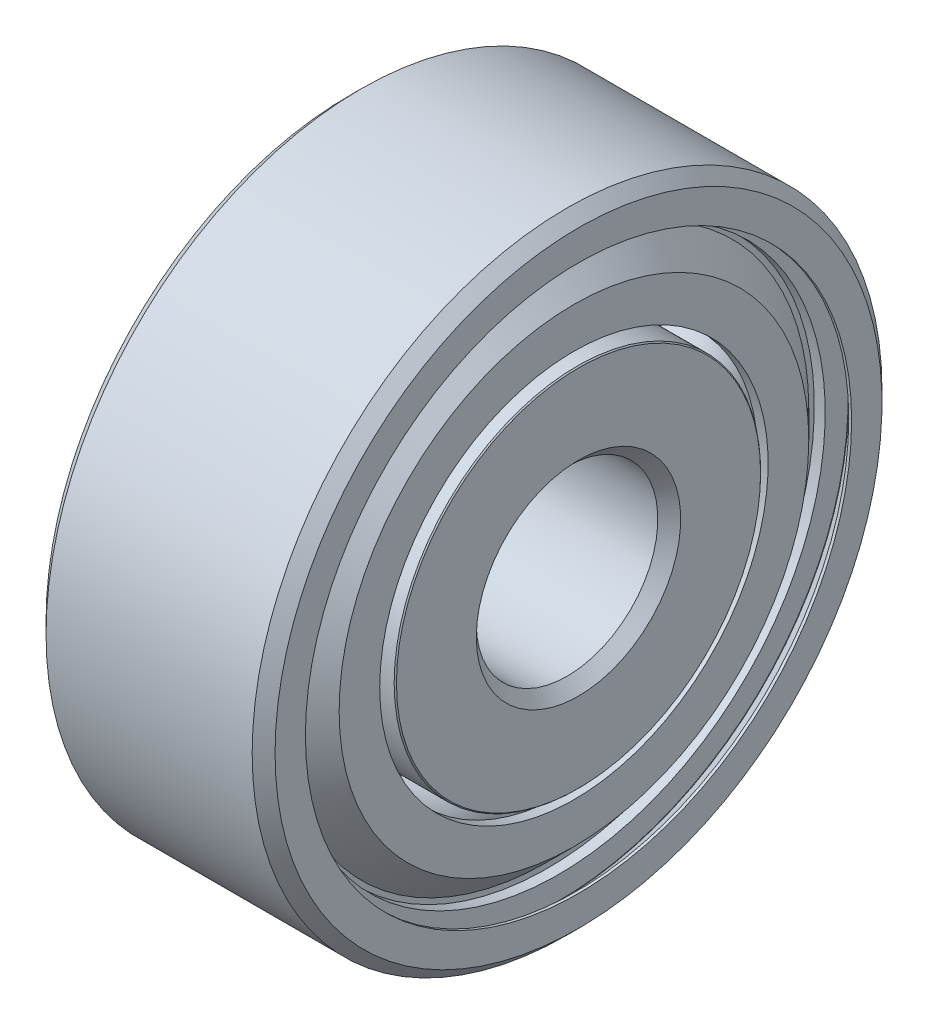
from build123d import *
from build123d.topology import SkipClean

# Parameters (mm, degrees)
SKETCH1_4_W       = 0.19
SKETCH1_4_H       = 0.4
CIRPATTERN2_COUNT = 8


with BuildPart() as part:
    # Sketch1 → Revolve1 (revolve)
    with BuildSketch(Plane.XY, mode=Mode.PRIVATE) as revolve1_sk:
        with BuildLine():
            ThreePointArc((1.00871205, 4.5), (0, 5.05), (-1.00871205, 4.5))
            Line((-1.00871205, 4.5), (-1.25, 4.5))
            Line((-1.25, 4.5), (-1.25, 4.77))
            Line((-1.25, 4.77), (-1.45, 4.77))
            Line((-1.45, 4.77), (-1.45, 5.07))
            Line((-1.45, 5.07), (-1.65, 5.07))
            Line((-1.65, 5.07), (-1.95, 4.77))
            Line((-1.95, 4.77), (-2, 4.77))
            Line((-2, 4.77), (-2, 5.3))
            Line((-2, 5.3), (-1.8, 5.5))
            Line((-1.8, 5.5), (1.8, 5.5))
            Line((1.8, 5.5), (2, 5.3))
            Line((2, 5.3), (2, 4.77))
            Line((2, 4.77), (1.95, 4.77))
            Line((1.95, 4.77), (1.65, 5.07))
            Line((1.65, 5.07), (1.45, 5.07))
            Line((1.45, 5.07), (1.45, 4.77))
            Line((1.45, 4.77), (1.25, 4.77))
            Line((1.25, 4.77), (1.25, 4.5))
            Line((1.25, 4.5), (1.00871205, 4.5))
        make_face()
        with BuildLine():
            ThreePointArc((-1.00871205, 3.2), (0, 2.65), (1.00871205, 3.2))
            Line((1.00871205, 3.2), (1.98, 3.2))
            Line((1.98, 3.2), (2, 3.18))
            Line((2, 3.18), (2, 1.785))
            Line((2, 1.785), (1.8, 1.585))
            Line((1.8, 1.585), (-1.8, 1.585))
            Line((-1.8, 1.585), (-2, 1.785))
            Line((-2, 1.785), (-2, 3.18))
            Line((-2, 3.18), (-1.98, 3.2))
            Line((-1.98, 3.2), (-1.00871205, 3.2))
        make_face()
    revolve(revolve1_sk.sketch.rotate(Axis((0, 0, 0), (1, 0, 0)), 90), axis=Axis((0, 0, 0), (1, 0, 0)))


with BuildPart() as body_2:
    # Sketch1<3> → Revolve2 (revolve)
    with BuildSketch(Plane.XY, mode=Mode.PRIVATE) as revolve2_sk:
        Polygon((1.92036514, 4.101237783), (1.92036514, 3.392543849), (1.74036514, 3.392543849), (1.74036514, 4.026679342), (1.267044482, 4.5), (1.267044482, 4.756515811), (1.447044482, 4.756515811), (1.447044482, 4.574558441), align=None)
        Polygon((-1.267044482, 4.5), (-1.267044482, 4.756515811), (-1.447044482, 4.756515811), (-1.447044482, 4.574558441), (-1.92036514, 4.101237783), (-1.92036514, 3.392543849), (-1.74036514, 3.392543849), (-1.74036514, 4.026679342), align=None)
    revolve(revolve2_sk.sketch.rotate(Axis((0, 0, 0), (1, 0, 0)), 90), axis=Axis((0, 0, 0), (1, 0, 0)))


with BuildPart() as body_3:
    # Sketch1<4> → Revolve3 (revolve)
    with BuildSketch(Plane.XY, mode=Mode.PRIVATE) as revolve3_sk:
        with Locations((1.553908134, 4.860421419)):
            Rectangle(SKETCH1_4_W, SKETCH1_4_H)
        with Locations((-1.553908134, 4.860421419)):
            Rectangle(SKETCH1_4_W, SKETCH1_4_H)
    revolve(revolve3_sk.sketch.rotate(Axis((0, 0, 0), (1, 0, 0)), 90), axis=Axis((0, 0, 0), (1, 0, 0)))


with BuildPart() as body_4:
    # Sketch1<5> → Revolve4 (revolve)
    with SkipClean():  # the faces are left unmerged after this step: merging them gives an invalid solid
        with BuildSketch(Plane.XY):
            with BuildLine():
                ThreePointArc((1.15, 3.85), (0.813172798, 4.663172798), (0, 5))
                Line((0, 5), (0, 2.7))
                ThreePointArc((0, 2.7), (0.813172798, 3.036827202), (1.15, 3.85))
            make_face()
            with BuildLine():
                Line((0, 2.7), (0, 5))
                ThreePointArc((0, 5), (-1.15, 3.85), (0, 2.7))
            make_face()
        revolve(axis=Axis((0, 5, 0), (0, -1, 0)))


with BuildPart() as cirpattern2_1:
    # CirPattern2: pattern copy
    add(body_4.part.rotate(Axis((0, 0, 0), (1, 0, 0)), 1 * 360 / CIRPATTERN2_COUNT))


with BuildPart() as cirpattern2_2:
    # CirPattern2: pattern copy
    add(body_4.part.rotate(Axis((0, 0, 0), (1, 0, 0)), 2 * 360 / CIRPATTERN2_COUNT))


with BuildPart() as cirpattern2_3:
    # CirPattern2: pattern copy
    add(body_4.part.rotate(Axis((0, 0, 0), (1, 0, 0)), 3 * 360 / CIRPATTERN2_COUNT))


with BuildPart() as cirpattern2_4:
    # CirPattern2: pattern copy
    add(body_4.part.rotate(Axis((0, 0, 0), (1, 0, 0)), 4 * 360 / CIRPATTERN2_COUNT))


with BuildPart() as cirpattern2_5:
    # CirPattern2: pattern copy
    add(body_4.part.rotate(Axis((0, 0, 0), (1, 0, 0)), 5 * 360 / CIRPATTERN2_COUNT))


with BuildPart() as cirpattern2_6:
    # CirPattern2: pattern copy
    add(body_4.part.rotate(Axis((0, 0, 0), (1, 0, 0)), 6 * 360 / CIRPATTERN2_COUNT))


with BuildPart() as cirpattern2_7:
    # CirPattern2: pattern copy
    add(body_4.part.rotate(Axis((0, 0, 0), (1, 0, 0)), 7 * 360 / CIRPATTERN2_COUNT))


solid = Compound([part.part, body_2.part, body_3.part, body_4.part, cirpattern2_1.part, cirpattern2_2.part, cirpattern2_3.part, cirpattern2_4.part, cirpattern2_5.part, cirpattern2_6.part, cirpattern2_7.part])
